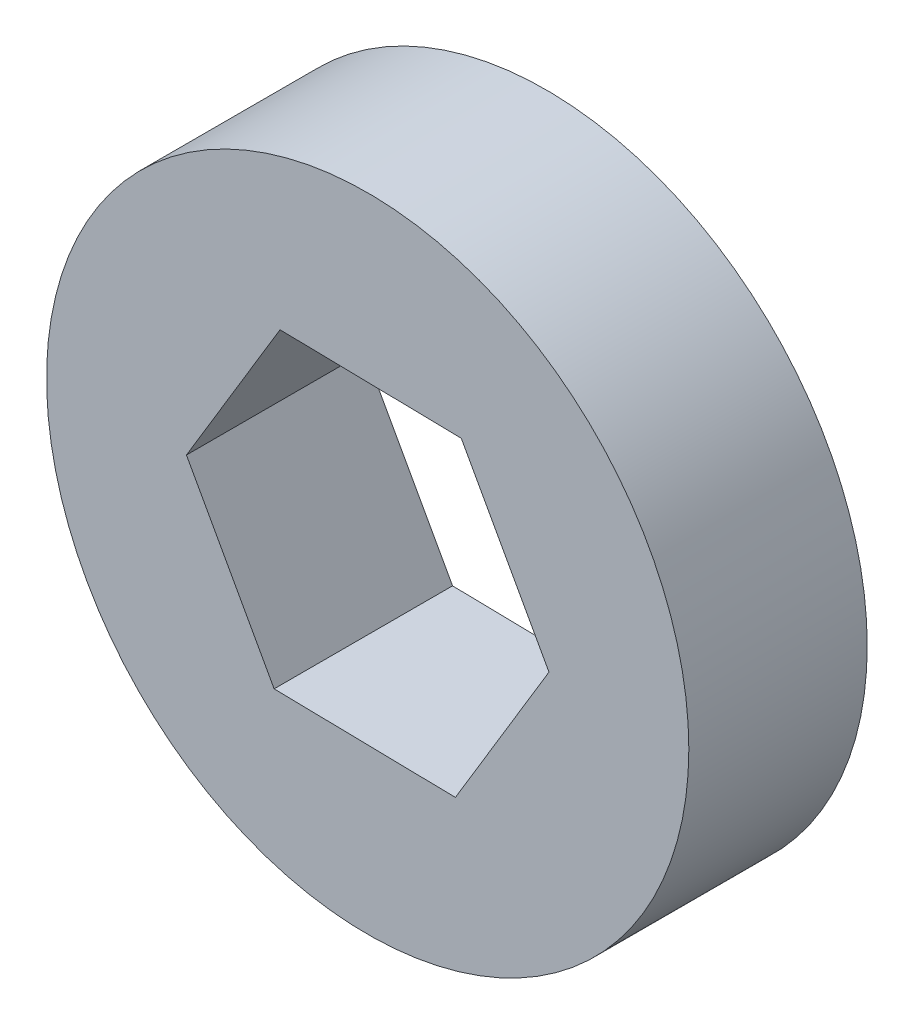
from build123d import *

# Parameters (mm, degrees)
SKETCH1_R           = 11.43
BOSS_EXTRUDE1_DEPTH = 6.35


with BuildPart() as part:
    # Sketch1 → Boss-Extrude1 (new body)
    with BuildSketch(Plane.XY):
        Circle(SKETCH1_R)
        Polygon((-3.330180634, -5.526682755), (3.121157347, -5.647362406), (6.451337982, -0.120679651), (3.330180634, 5.526682755), (-3.121157347, 5.647362406), (-6.451337982, 0.120679651), align=None, mode=Mode.SUBTRACT)
    extrude(amount=BOSS_EXTRUDE1_DEPTH)


solid = part.part
